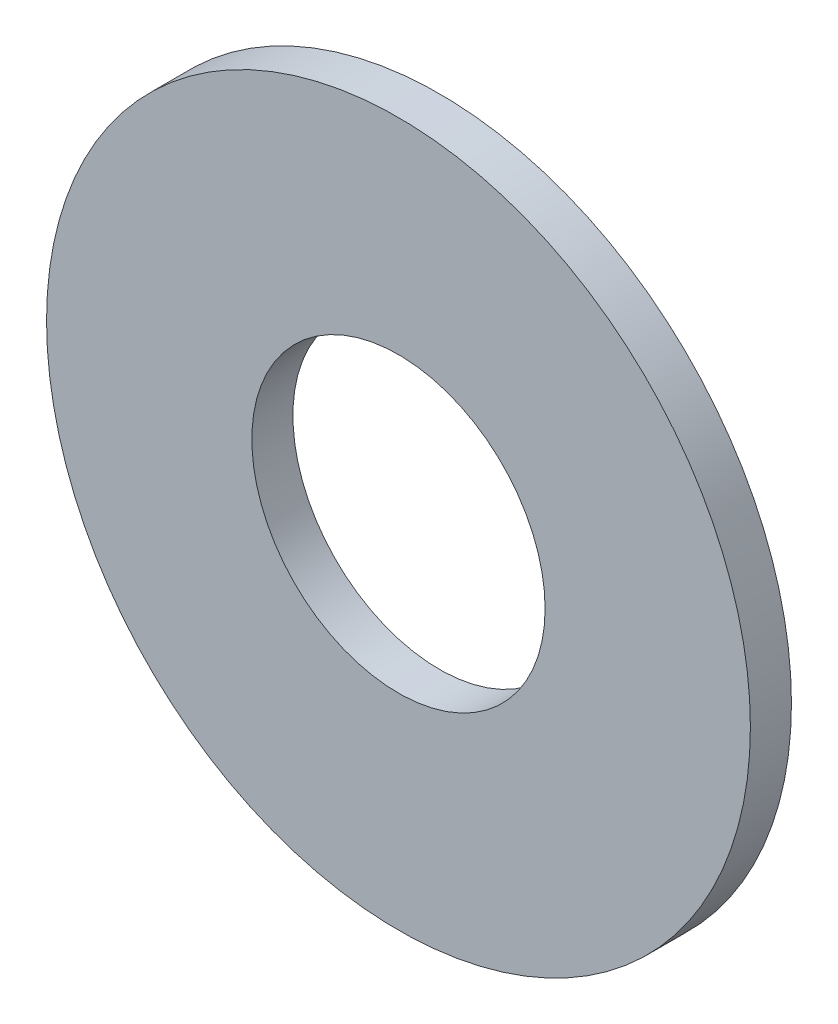
from build123d import *

# Parameters (mm, degrees)
SKETCH1_R           = 12
SKETCH1_R_2         = 5
BOSS_EXTRUDE1_DEPTH = 1.4


with BuildPart() as part:
    # Sketch1 → Boss-Extrude1 (new body)
    with BuildSketch(Plane.XY):
        Circle(SKETCH1_R)
        Circle(SKETCH1_R_2, mode=Mode.SUBTRACT)
    extrude(amount=BOSS_EXTRUDE1_DEPTH)


solid = part.part
